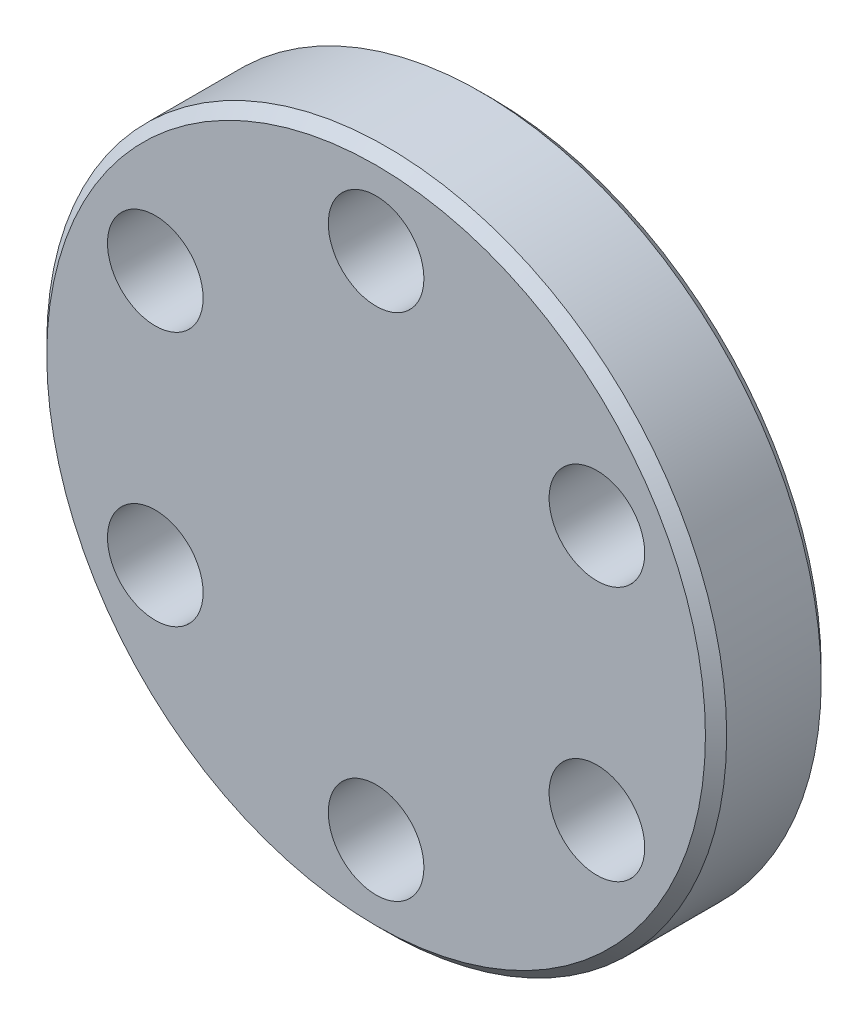
from build123d import *

# Parameters (mm, degrees)
SKIZZE1_R                       = 16
AUFSATZ_LINEAR_AUSTRAGEN1_DEPTH = 2.725
DURCHGANGSLOCH_F_R_M41_D        = 4.5
FASE1_SIZE                      = 0.5


with BuildPart() as part:
    # Skizze1 → Aufsatz-Linear austragen1 (new, symmetric)
    with BuildSketch(Plane.XY):
        Circle(SKIZZE1_R)
    extrude(amount=AUFSATZ_LINEAR_AUSTRAGEN1_DEPTH, both=True)

    # Durchgangsloch für M41 (through all)
    with Locations(Plane.XY.offset(2.725)):
        with Locations((-10.392304845, 6), (0, 12), (10.392304845, 6), (10.392304845, -6), (0, -12), (-10.392304845, -6)):
            Hole(DURCHGANGSLOCH_F_R_M41_D / 2)

    # Fase1
    fase1_edges = [part.edges().sort_by_distance(p)[0] for p in [
        (-16, 0, -2.725),
        (-16, 0, 2.725),
    ]]
    chamfer(fase1_edges, length=FASE1_SIZE)


solid = part.part
